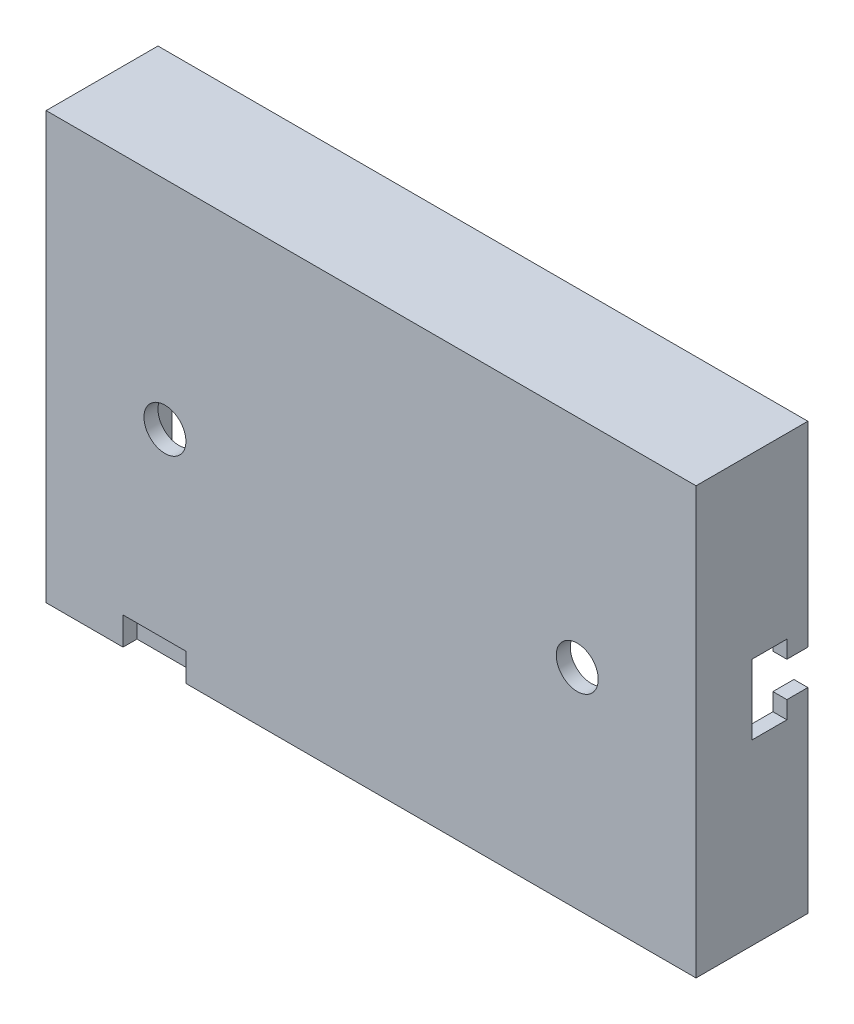
from build123d import *

# Parameters (mm, degrees)
ESQUISSE1_W             = 89
ESQUISSE1_H             = 57
BOSS_EXTRU_1_DEPTH      = 2
ESQUISSE2_W             = 16
ESQUISSE2_H             = 57
BOSS_EXTRU_2_DEPTH      = 2
ESQUISSE3_W             = 16
ESQUISSE3_H             = 57
BOSS_EXTRU_3_DEPTH      = 2
ESQUISSE4_W             = 93
ESQUISSE4_H             = 16
BOSS_EXTRU_4_DEPTH      = 2
ESQUISSE5_W             = 93
ESQUISSE5_H             = 16
BOSS_EXTRU_5_DEPTH      = 2
ESQUISSE6_R             = 3
ENL_V_MAT_EXTRU_1_DEPTH = 2
ESQUISSE7_R             = 3
ENL_V_MAT_EXTRU_2_DEPTH = 2
ESQUISSE11_W            = 5
ESQUISSE11_H            = 10
ENL_V_MAT_EXTRU_3_DEPTH = 2
ESQUISSE13_W            = 2.999998882
ESQUISSE13_H            = 5
ENL_V_MAT_EXTRU_4_DEPTH = 2
ESQUISSE14_W            = 9
ESQUISSE14_H            = 4
ENL_V_MAT_EXTRU_7_DEPTH = 2


with BuildPart() as part:
    # Esquisse1 → Boss.-Extru.1 (new body)
    with BuildSketch(Plane.XY):
        with Locations((4.166807432, -5.391891892)):
            Rectangle(ESQUISSE1_W, ESQUISSE1_H)
    extrude(amount=BOSS_EXTRU_1_DEPTH)

    # Esquisse2 → Boss.-Extru.2 (add)
    with BuildSketch(Plane(origin=(48.666807432, 0, 0), x_dir=(0, 0, -1), z_dir=(1, 0, 0))):
        with Locations((6, -5.391891892)):
            Rectangle(ESQUISSE2_W, ESQUISSE2_H)
    extrude(amount=BOSS_EXTRU_2_DEPTH)

    # Esquisse3 → Boss.-Extru.3 (add)
    with BuildSketch(Plane.ZY.offset(40.333192568)):
        with Locations((-6, -5.391891892)):
            Rectangle(ESQUISSE3_W, ESQUISSE3_H)
    extrude(amount=BOSS_EXTRU_3_DEPTH)

    # Esquisse4 → Boss.-Extru.4 (add)
    with BuildSketch(Plane.XZ.offset(33.891891892)):
        with Locations((4.166807432, -6)):
            Rectangle(ESQUISSE4_W, ESQUISSE4_H)
    extrude(amount=BOSS_EXTRU_4_DEPTH)

    # Esquisse5 → Boss.-Extru.5 (add)
    with BuildSketch(Plane(origin=(0, 23.108108108, 0), x_dir=(1, 0, 0), z_dir=(0, 1, 0))):
        with Locations((4.166807432, 6)):
            Rectangle(ESQUISSE5_W, ESQUISSE5_H)
    extrude(amount=BOSS_EXTRU_5_DEPTH)

    # Esquisse6 → Enlèv. mat.-Extru.1 (cut)
    with BuildSketch(Plane(origin=(0, 0, 0), x_dir=(-1, 0, 0), z_dir=(0, 0, -1))):
        with Locations((25.333192568, -5.891891892)):
            Circle(ESQUISSE6_R)
    extrude(amount=-ENL_V_MAT_EXTRU_1_DEPTH, mode=Mode.SUBTRACT)

    # Esquisse7 → Enlèv. mat.-Extru.2 (cut)
    with BuildSketch(Plane(origin=(0, 0, 0), x_dir=(-1, 0, 0), z_dir=(0, 0, -1))):
        with Locations((-33.666807432, -5.891891892)):
            Circle(ESQUISSE7_R)
    extrude(amount=-ENL_V_MAT_EXTRU_2_DEPTH, mode=Mode.SUBTRACT)

    # Esquisse11 → Enlèv. mat.-Extru.3 (cut)
    with BuildSketch(Plane(origin=(50.666807432, 0, 0), x_dir=(0, 0, -1), z_dir=(1, 0, 0))):
        with Locations((8.500001118, -5.394481666)):
            Rectangle(ESQUISSE11_W, ESQUISSE11_H)
    extrude(amount=-ENL_V_MAT_EXTRU_3_DEPTH, mode=Mode.SUBTRACT)

    # Esquisse13 → Enlèv. mat.-Extru.4 (cut)
    with BuildSketch(Plane(origin=(50.666807432, 0, 0), x_dir=(0, 0, -1), z_dir=(1, 0, 0))):
        with Locations((12.500000559, -5.394481666)):
            Rectangle(ESQUISSE13_W, ESQUISSE13_H)
    extrude(amount=-ENL_V_MAT_EXTRU_4_DEPTH, mode=Mode.SUBTRACT)

    # Esquisse14 → Enlèv. mat.-Extru.7 (cut)
    with BuildSketch(Plane.XY.offset(2)):
        with Locations((-26.833192568, -33.891891892)):
            Rectangle(ESQUISSE14_W, ESQUISSE14_H)
    extrude(amount=-ENL_V_MAT_EXTRU_7_DEPTH, mode=Mode.SUBTRACT)


solid = part.part
